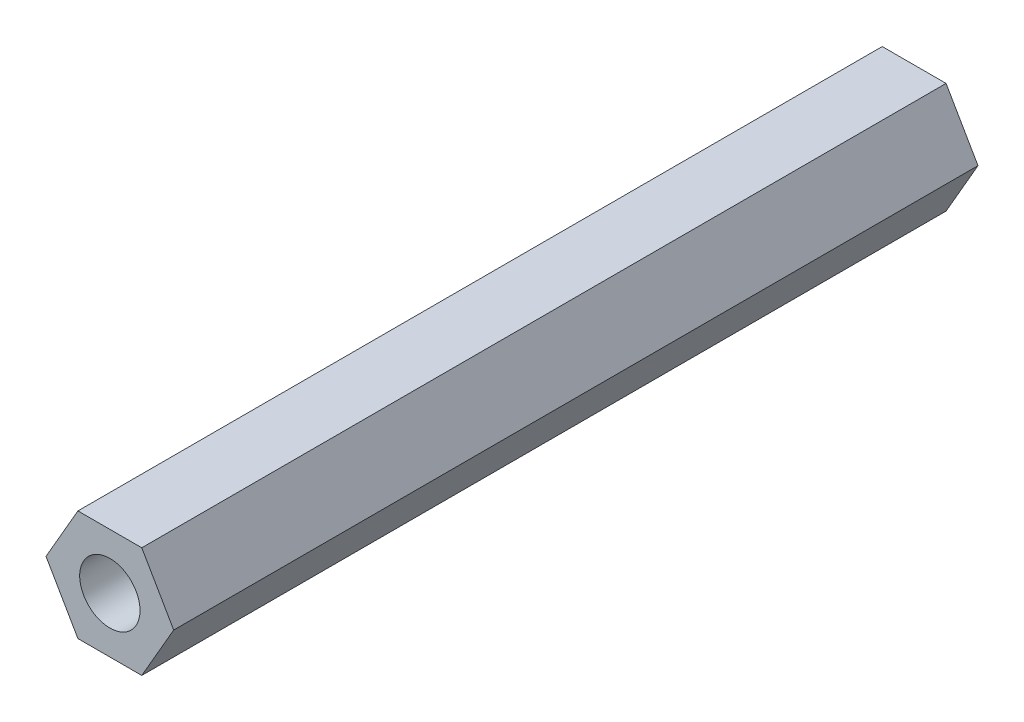
from build123d import *

# Parameters (mm, degrees)
SKETCH_1_R      = 1.5
EXTRUDE_1_DEPTH = 40


with BuildPart() as part:
    # Эскиз1 → Бобышка-Вытянуть1 (new body)
    with BuildSketch(Plane.XY):
        Polygon((3.175426481, 0), (1.58771324, 2.75), (-1.58771324, 2.75), (-3.175426481, 0), (-1.58771324, -2.75), (1.58771324, -2.75), align=None)
        Circle(SKETCH_1_R, mode=Mode.SUBTRACT)
    extrude(amount=EXTRUDE_1_DEPTH)


solid = part.part
